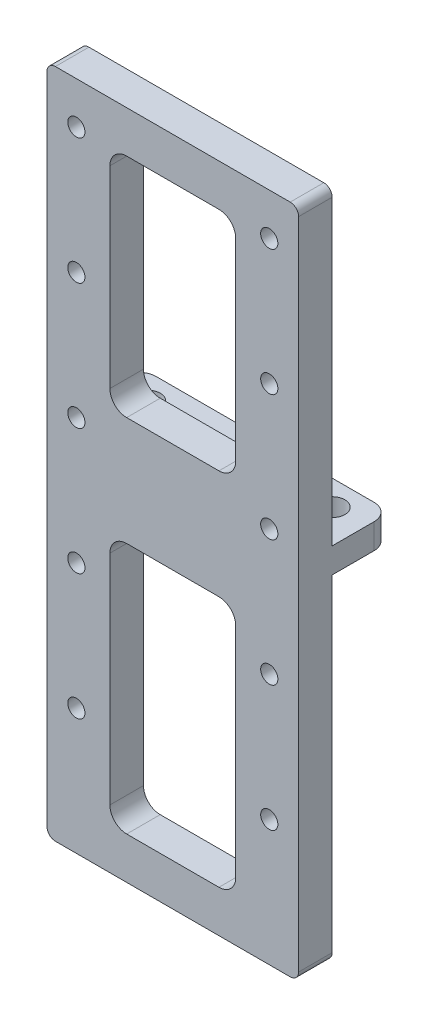
from build123d import *

# Parameters (mm, degrees)
SKETCH_1_W             = 30
SKETCH_1_H             = 80
EXTRUDE_1_DEPTH        = 4
SKETCH_2_R             = 1.025
CUT_EXTRUDE_1_DEPTH    = 10
PATTERN_LINEAR_1_COUNT = 5
PATTERN_LINEAR_1_PITCH = 15
SKETCH_5_W             = 30
SKETCH_5_H             = 3
EXTRUDE_3_DEPTH        = 7
FILLET_1_R             = 1
SKETCH_6_W             = 15
SKETCH_6_H             = 27
CUT_EXTRUDE_2_DEPTH    = 33
FILLET_2_R             = 2
SKETCH_7_W             = 15
SKETCH_7_H             = 30
CUT_EXTRUDE_3_DEPTH    = 33
FILLET_3_R             = 2
SKETCH_10_R            = 1.525
CUT_EXTRUDE_6_DEPTH    = 33
FILLET_5_R             = 2


with BuildPart() as part:
    # 草图1 → 凸台-拉伸1 (new body)
    with BuildSketch(Plane.XY):
        Rectangle(SKETCH_1_W, SKETCH_1_H)
    extrude(amount=EXTRUDE_1_DEPTH)

    # 草图2 → 切除-拉伸1 (cut)
    with BuildSketch(Plane.XY.offset(4)):
        with Locations((11.5, 35)):
            Circle(SKETCH_2_R)
        with Locations((-11.5, 35)):
            Circle(SKETCH_2_R)
    cut_extrude_1 = extrude(amount=-CUT_EXTRUDE_1_DEPTH, mode=Mode.SUBTRACT)

    # 阵列(线性)1: 切除-拉伸1 ×5
    with Locations(*[(0, -i * PATTERN_LINEAR_1_PITCH, 0) for i in range(1, PATTERN_LINEAR_1_COUNT)]):
        add(cut_extrude_1, mode=Mode.SUBTRACT)

    # 草图5 → 凸台-拉伸3 (add)
    with BuildSketch(Plane(origin=(0, 0, 0), x_dir=(-1, 0, 0), z_dir=(0, 0, -1))):
        with Locations((0, 1.5)):
            Rectangle(SKETCH_5_W, SKETCH_5_H)
    extrude(amount=EXTRUDE_3_DEPTH)

    # 圆角1
    fillet_1_edges = [part.edges().sort_by_distance(p)[0] for p in [
        (15, -40, 2),
        (-15, -40, 2),
        (-15, 40, 2),
        (15, 40, 2),
    ]]
    fillet(fillet_1_edges, radius=FILLET_1_R)

    # 草图6 → 切除-拉伸2 (cut, symmetric)
    with BuildSketch(Plane(origin=(0, 0, 0), x_dir=(-1, 0, 0), z_dir=(0, 0, -1))):
        with Locations((0, 21.5)):
            Rectangle(SKETCH_6_W, SKETCH_6_H)
    extrude(amount=CUT_EXTRUDE_2_DEPTH, both=True, mode=Mode.SUBTRACT)

    # 圆角2
    fillet_2_edges = [part.edges().sort_by_distance(p)[0] for p in [
        (-7.5, 35, 2),
        (-7.5, 8, 2),
        (7.5, 8, 2),
        (7.5, 35, 2),
    ]]
    fillet(fillet_2_edges, radius=FILLET_2_R)

    # 草图7 → 切除-拉伸3 (cut, symmetric)
    with BuildSketch(Plane(origin=(0, 0, 0), x_dir=(-1, 0, 0), z_dir=(0, 0, -1))):
        with Locations((0, -20)):
            Rectangle(SKETCH_7_W, SKETCH_7_H)
    extrude(amount=CUT_EXTRUDE_3_DEPTH, both=True, mode=Mode.SUBTRACT)

    # 圆角3
    fillet_3_edges = [part.edges().sort_by_distance(p)[0] for p in [
        (-7.5, -5, 2),
        (-7.5, -35, 2),
        (7.5, -35, 2),
        (7.5, -5, 2),
    ]]
    fillet(fillet_3_edges, radius=FILLET_3_R)

    # 草图10 → 切除-拉伸6 (cut, symmetric)
    with BuildSketch(Plane(origin=(0, 3, 0), x_dir=(1, 0, 0), z_dir=(0, 1, 0))):
        with Locations(Location((11, 4, 0), (0, 0, 270))):
            Circle(SKETCH_10_R)
        with Locations(Location((-11, 4, 0), (0, 0, 270))):
            Circle(SKETCH_10_R)
    extrude(amount=CUT_EXTRUDE_6_DEPTH, both=True, mode=Mode.SUBTRACT)

    # 圆角5
    fillet_5_edges = [part.edges().sort_by_distance(p)[0] for p in [
        (15, 1.5, -7),
        (-15, 1.5, -7),
    ]]
    fillet(fillet_5_edges, radius=FILLET_5_R)


solid = part.part
